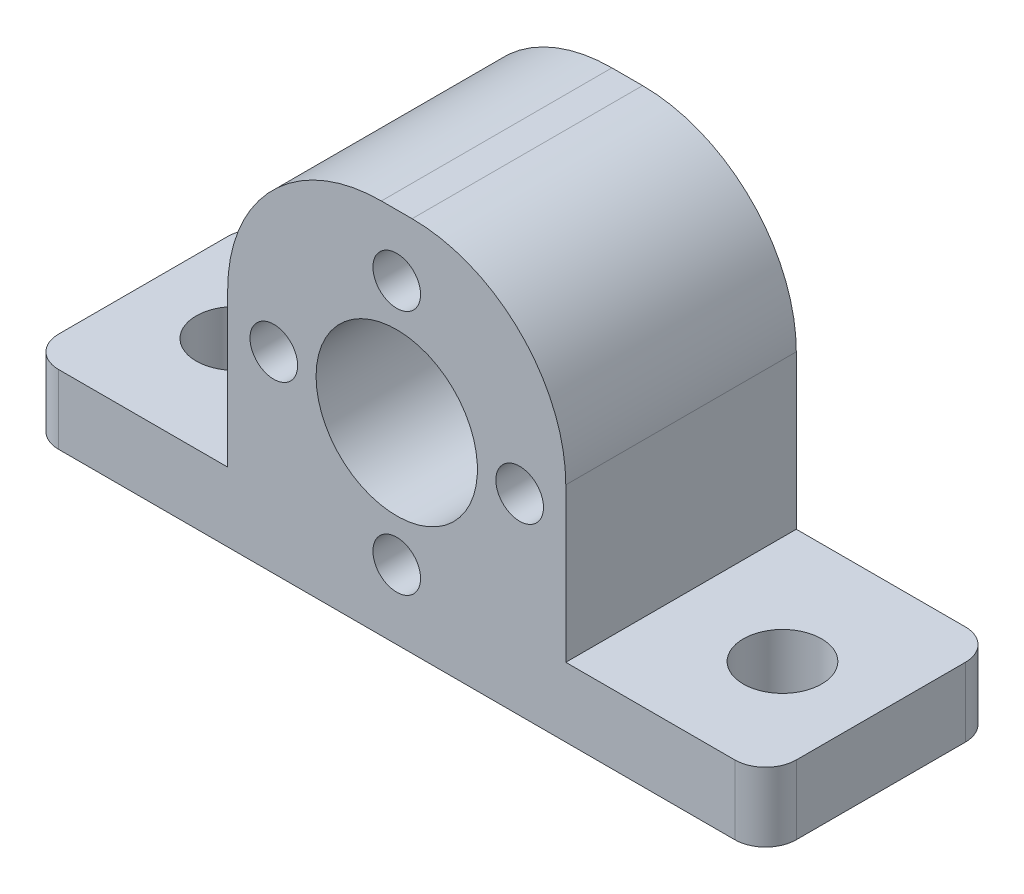
from build123d import *

# Parameters (mm, degrees)
SKETCH_1_W          = 48
SKETCH_1_H          = 15
EXTRUDE_1_DEPTH     = 4.5
SKETCH_2_W          = 22
SKETCH_2_H          = 15
EXTRUDE_2_DEPTH     = 20
FILLET_1_R          = 10
SKETCH_3_R          = 2.55
CUT_EXTRUDE_1_DEPTH = 34.700354834
SKETCH_4_R          = 5.25
SKETCH_4_R_2        = 1.55
CUT_EXTRUDE_2_DEPTH = 20
FILLET_2_R          = 2


with BuildPart() as part:
    # 草图1 → 凸台-拉伸1 (new body)
    with BuildSketch(Plane(origin=(0, 0, 0), x_dir=(1, 0, 0), z_dir=(0, 1, 0))):
        with Locations((-1.948504983, 0.398671096)):
            Rectangle(SKETCH_1_W, SKETCH_1_H)
    extrude(amount=EXTRUDE_1_DEPTH)

    # 草图2 → 凸台-拉伸2 (add)
    with BuildSketch(Plane(origin=(0, 4.5, 0), x_dir=(1, 0, 0), z_dir=(0, 1, 0))):
        with Locations((-1.948504983, 0.398671096)):
            Rectangle(SKETCH_2_W, SKETCH_2_H)
    extrude(amount=EXTRUDE_2_DEPTH)

    # 圆角1
    fillet_1_edges = [part.edges().sort_by_distance(p)[0] for p in [
        (-12.948504983, 24.5, -0.398671096),
        (9.051495017, 24.5, -0.398671096),
    ]]
    fillet(fillet_1_edges, radius=FILLET_1_R)

    # 草图3 → 切除-拉伸1 (cut, through all)
    with BuildSketch(Plane(origin=(0, 4.5, 0), x_dir=(1, 0, 0), z_dir=(0, 1, 0))):
        with Locations(Location((-19.948504983, 0.398671096, 0), (0, 0, 270))):
            Circle(SKETCH_3_R)
        with Locations(Location((16.051495017, 0, 0), (0, 0, 270))):
            Circle(SKETCH_3_R)
    extrude(amount=-CUT_EXTRUDE_1_DEPTH, mode=Mode.SUBTRACT)

    # 草图4 → 切除-拉伸2 (cut)
    with BuildSketch(Plane(origin=(0, 0, -7.898671096), x_dir=(-1, 0, 0), z_dir=(0, 0, -1))):
        with Locations((1.948504983, 12.5)):
            Circle(SKETCH_4_R)
        with Locations((1.948504983, 20.5)):
            Circle(SKETCH_4_R_2)
        with Locations((9.948504983, 12.5)):
            Circle(SKETCH_4_R_2)
        with Locations((1.948504983, 4.5)):
            Circle(SKETCH_4_R_2)
        with Locations((-6.051495017, 12.5)):
            Circle(SKETCH_4_R_2)
    extrude(amount=-CUT_EXTRUDE_2_DEPTH, mode=Mode.SUBTRACT)

    # 圆角2
    fillet_2_edges = [part.edges().sort_by_distance(p)[0] for p in [
        (-25.948504983, 2.25, -7.898671096),
        (22.051495017, 2.25, -7.898671096),
        (22.051495017, 2.25, 7.101328904),
        (-25.948504983, 2.25, 7.101328904),
    ]]
    fillet(fillet_2_edges, radius=FILLET_2_R)


solid = part.part
